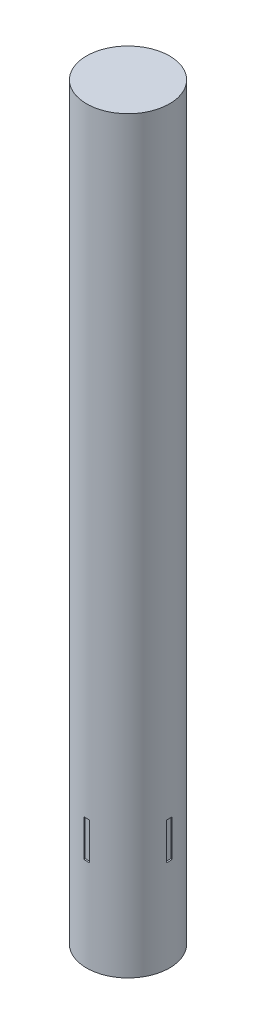
from build123d import *

# Parameters (mm, degrees)
SKETCH1_W           = 112
SKETCH1_H           = 2020
SKETCH2_W           = 15
SKETCH2_H           = 100
CUT_EXTRUDE1_DEPTH  = 132
SKETCH3_W           = 15
SKETCH3_H           = 100
BOSS_EXTRUDE1_DEPTH = 108
CIRPATTERN1_COUNT   = 4
SKETCH4_R           = 107
CUT_EXTRUDE2_DEPTH  = 200


with BuildPart() as part:
    # Sketch1 → Revolve1 (revolve)
    with BuildSketch(Plane.XY, mode=Mode.PRIVATE) as revolve1_sk:
        with Locations((56, -1010)):
            Rectangle(SKETCH1_W, SKETCH1_H)
    revolve(revolve1_sk.sketch.rotate(Axis((0, -2406.253229974, 0), (0, 1, 0)), 90), axis=Axis((0, -2406.253229974, 0), (0, 1, 0)))

    # Sketch2 → Cut-Extrude1 (cut)
    with BuildSketch(Plane.XY):
        with Locations((0, -1720)):
            Rectangle(SKETCH2_W, SKETCH2_H)
    cut_extrude1 = extrude(amount=-CUT_EXTRUDE1_DEPTH, mode=Mode.SUBTRACT)

    # Sketch3 → Boss-Extrude1 (add)
    with BuildSketch(Plane(origin=(0, 0, 0), x_dir=(-1, 0, 0), z_dir=(0, 0, -1))):
        with Locations((0, -1720)):
            Rectangle(SKETCH3_W, SKETCH3_H)
    boss_extrude1 = extrude(amount=BOSS_EXTRUDE1_DEPTH)

    # CirPattern1: Cut-Extrude1, Boss-Extrude1 ×4 about axis
    cirpattern1_axis = Axis((0, 0, 0), (0, 1, 0))
    add([cut_extrude1.rotate(cirpattern1_axis, i * 360 / CIRPATTERN1_COUNT) for i in range(1, CIRPATTERN1_COUNT)], mode=Mode.SUBTRACT)
    add([boss_extrude1.rotate(cirpattern1_axis, i * 360 / CIRPATTERN1_COUNT) for i in range(1, CIRPATTERN1_COUNT)])

    # Sketch4 → Cut-Extrude2 (cut)
    with BuildSketch(Plane.XZ.offset(2020)):
        with Locations(Location((0, 0, 0), (0, 0, 270))):
            Circle(SKETCH4_R)
    extrude(amount=-CUT_EXTRUDE2_DEPTH, mode=Mode.SUBTRACT)


solid = part.part
